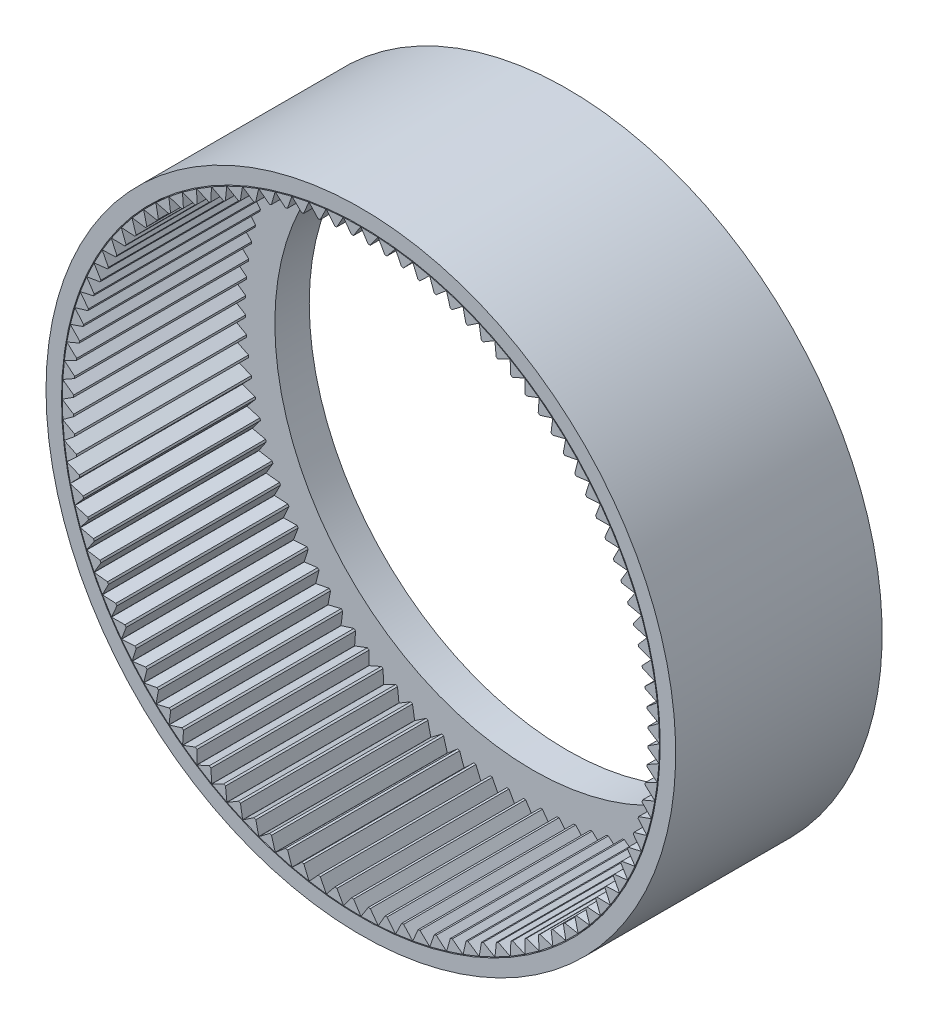
from build123d import *

# Parameters (mm, degrees)
SALIENTE_EXTRUIR1_DEPTH = 5
CROQUIS3_R              = 9.15
CROQUIS3_R_2            = 8.7
SALIENTE_EXTRUIR2_DEPTH = 5
CROQUIS4_R              = 9.15
CROQUIS4_R_2            = 7.5
SALIENTE_EXTRUIR5_DEPTH = 1


with BuildPart() as part:
    # Croquis2 → Saliente-Extruir1 (new body)
    with BuildSketch(Plane.XY):
        Polygon((0, 8.67551423), (0.210718239, 8.347340764), (0.270718239, 8.345610321), (0.5, 8.661093877), align=None)
        Polygon((0.504436291, 8.660836633), (1.002751901, 8.617368263), (0.755514311, 8.315750004), (0.695716438, 8.320966208), align=None)
        Polygon((1.007165728, 8.616853506), (1.502110807, 8.544484202), (1.237753961, 8.257751821), (1.178360552, 8.266436137), align=None)
        Polygon((1.506487236, 8.543713675), (1.996387045, 8.442688311), (1.715805444, 8.171812019), (1.657017467, 8.183935063), align=None)
        Polygon((2.000711268, 8.441664621), (2.483908141, 8.312325035), (2.188051185, 8.058221393), (2.13006756, 8.073742143), align=None)
        Polygon((2.488165526, 8.311051646), (2.963024479, 8.153835483), (2.652893253, 7.917364296), (2.595910178, 7.936230235), align=None)
        Polygon((2.96720062, 8.152316703), (3.43211488, 7.967755933), (3.10875877, 7.749717344), (3.052969058, 7.771864636), align=None)
        Polygon((3.436195646, 7.965996901), (3.88959209, 7.754716018), (3.554105231, 7.555847802), (3.499697658, 7.581201508), align=None)
        Polygon((3.893563674, 7.752722687), (4.333908152, 7.515436599), (3.987425725, 7.336411663), (3.934584388, 7.364885993), align=None)
        Polygon((4.337757115, 7.513215714), (4.76355964, 7.250727322), (4.407254033, 7.092151429), (4.35615773, 7.123650036), align=None)
        Polygon((4.767272959, 7.248286397), (5.177092751, 6.961483879), (4.812169588, 6.823893599), (4.762991213, 6.858309902), align=None)
        Polygon((5.18065786, 6.958831173), (5.573108219, 6.648684978), (5.200802284, 6.532545874), (5.153708241, 6.569763418), align=None)
        Polygon((5.576513054, 6.645829467), (5.950266052, 6.313389031), (5.571837112, 6.219094081), (5.526986753, 6.258986934), align=None)
        Polygon((5.953499094, 6.310340378), (6.307290069, 5.956730574), (5.924018607, 5.884598843), (5.88156369, 5.927032019), align=None)
        Polygon((6.310340378, 5.953499094), (6.642972212, 5.579916427), (6.256155098, 5.530191985), (6.216239278, 5.575021905), align=None)
        Polygon((6.645829467, 5.576513054), (6.956176641, 5.184221609), (6.567122741, 5.157072707), (6.52988108, 5.204147681), align=None)
        Polygon((6.958831173, 5.18065786), (7.245843569, 4.770985026), (6.855869319, 4.766503528), (6.821427831, 4.815664268), align=None)
        Polygon((7.248286397, 4.767272959), (7.510992857, 4.34160494), (7.121417805, 4.35980601), (7.08989303, 4.410886172), align=None)
        Polygon((7.513215714, 4.337757115), (7.750727322, 3.897534237), (7.362869668, 3.938356289), (7.334368275, 3.991183034), align=None)
        Polygon((7.752722687, 3.893563674), (7.96423578, 3.440275512), (7.57940791, 3.503580416), (7.554026339, 3.557974995), align=None)
        Polygon((7.965996901, 3.436195646), (8.150795784, 2.971375983), (7.770299835, 3.056949536), (7.74812397, 3.112727896), align=None)
        Polygon((8.152316703, 2.96720062), (8.309776076, 2.492422259), (7.934899526, 2.599974907), (7.916004401, 2.65694831), align=None)
        Polygon((8.311051646, 2.488165526), (8.440638716, 2.005034967), (8.072650028, 2.134202785), (8.057099579, 2.192178453), align=None)
        Polygon((8.441664621, 2.000711268), (8.542940906, 1.510863271), (8.183085237, 1.661209197), (8.170932083, 1.719990957), align=None)
        Polygon((8.543713675, 1.506487236), (8.616336489, 1.011579292), (8.265831477, 1.182594603), (8.257116739, 1.241983557), align=None)
        Polygon((8.616853506, 1.007165728), (8.660577116, 0.508872449), (8.320608759, 0.699978483), (8.315361926, 0.759773677), align=None)
        Polygon((8.660836633, 0.504436291), (8.675513092, 0.004443743), (8.347231735, 0.214993858), (8.34547056, 0.274992964), align=None)
        Polygon((8.67551423, 0), (8.661093877, -0.5), (8.345610321, -0.270718239), (8.347340764, -0.210718239), align=None)
        Polygon((8.660836633, -0.504436291), (8.617368263, -1.002751901), (8.315750004, -0.755514311), (8.320966208, -0.695716438), align=None)
        Polygon((8.616853506, -1.007165728), (8.544484202, -1.502110807), (8.257751821, -1.237753961), (8.266436137, -1.178360552), align=None)
        Polygon((8.543713675, -1.506487236), (8.442688311, -1.996387045), (8.171812019, -1.715805444), (8.183935063, -1.657017467), align=None)
        Polygon((8.441664621, -2.000711268), (8.312325035, -2.483908141), (8.058221393, -2.188051185), (8.073742143, -2.13006756), align=None)
        Polygon((8.311051646, -2.488165526), (8.153835483, -2.963024479), (7.917364296, -2.652893253), (7.936230235, -2.595910178), align=None)
        Polygon((8.152316703, -2.96720062), (7.967755933, -3.43211488), (7.749717344, -3.10875877), (7.771864636, -3.052969058), align=None)
        Polygon((7.965996901, -3.436195646), (7.754716018, -3.88959209), (7.555847802, -3.554105231), (7.581201508, -3.499697658), align=None)
        Polygon((7.752722687, -3.893563674), (7.515436599, -4.333908152), (7.336411663, -3.987425725), (7.364885993, -3.934584388), align=None)
        Polygon((7.513215714, -4.337757115), (7.250727322, -4.76355964), (7.092151429, -4.407254033), (7.123650036, -4.35615773), align=None)
        Polygon((7.248286397, -4.767272959), (6.961483879, -5.177092751), (6.823893599, -4.812169588), (6.858309902, -4.762991213), align=None)
        Polygon((6.958831173, -5.18065786), (6.648684978, -5.573108219), (6.532545874, -5.200802284), (6.569763418, -5.153708241), align=None)
        Polygon((6.645829467, -5.576513054), (6.313389031, -5.950266052), (6.219094081, -5.571837112), (6.258986934, -5.526986753), align=None)
        Polygon((6.310340378, -5.953499094), (5.956730574, -6.307290069), (5.884598843, -5.924018607), (5.927032019, -5.88156369), align=None)
        Polygon((5.953499094, -6.310340378), (5.579916427, -6.642972212), (5.530191985, -6.256155098), (5.575021905, -6.216239278), align=None)
        Polygon((5.576513054, -6.645829467), (5.184221609, -6.956176641), (5.157072707, -6.567122741), (5.204147681, -6.52988108), align=None)
        Polygon((5.18065786, -6.958831173), (4.770985026, -7.245843569), (4.766503528, -6.855869319), (4.815664268, -6.821427831), align=None)
        Polygon((4.767272959, -7.248286397), (4.34160494, -7.510992857), (4.35980601, -7.121417805), (4.410886172, -7.08989303), align=None)
        Polygon((4.337757115, -7.513215714), (3.897534237, -7.750727322), (3.938356289, -7.362869668), (3.991183034, -7.334368275), align=None)
        Polygon((3.893563674, -7.752722687), (3.440275512, -7.96423578), (3.503580416, -7.57940791), (3.557974995, -7.554026339), align=None)
        Polygon((3.436195646, -7.965996901), (2.971375983, -8.150795784), (3.056949536, -7.770299835), (3.112727896, -7.74812397), align=None)
        Polygon((2.96720062, -8.152316703), (2.492422259, -8.309776076), (2.599974907, -7.934899526), (2.65694831, -7.916004401), align=None)
        Polygon((2.488165526, -8.311051646), (2.005034967, -8.440638716), (2.134202785, -8.072650028), (2.192178453, -8.057099579), align=None)
        Polygon((2.000711268, -8.441664621), (1.510863271, -8.542940906), (1.661209197, -8.183085237), (1.719990957, -8.170932083), align=None)
        Polygon((1.506487236, -8.543713675), (1.011579292, -8.616336489), (1.182594603, -8.265831477), (1.241983557, -8.257116739), align=None)
        Polygon((1.007165728, -8.616853506), (0.508872449, -8.660577116), (0.699978483, -8.320608759), (0.759773677, -8.315361926), align=None)
        Polygon((0.504436291, -8.660836633), (0.004443743, -8.675513092), (0.214993858, -8.347231735), (0.274992964, -8.34547056), align=None)
        Polygon((0, -8.67551423), (-0.5, -8.661093877), (-0.270718239, -8.345610321), (-0.210718239, -8.347340764), align=None)
        Polygon((-0.504436291, -8.660836633), (-1.002751901, -8.617368263), (-0.755514311, -8.315750004), (-0.695716438, -8.320966208), align=None)
        Polygon((-1.007165728, -8.616853506), (-1.502110807, -8.544484202), (-1.237753961, -8.257751821), (-1.178360552, -8.266436137), align=None)
        Polygon((-1.506487236, -8.543713675), (-1.996387045, -8.442688311), (-1.715805444, -8.171812019), (-1.657017467, -8.183935063), align=None)
        Polygon((-2.000711268, -8.441664621), (-2.483908141, -8.312325035), (-2.188051185, -8.058221393), (-2.13006756, -8.073742143), align=None)
        Polygon((-2.488165526, -8.311051646), (-2.963024479, -8.153835483), (-2.652893253, -7.917364296), (-2.595910178, -7.936230235), align=None)
        Polygon((-2.96720062, -8.152316703), (-3.43211488, -7.967755933), (-3.10875877, -7.749717344), (-3.052969058, -7.771864636), align=None)
        Polygon((-3.436195646, -7.965996901), (-3.88959209, -7.754716018), (-3.554105231, -7.555847802), (-3.499697658, -7.581201508), align=None)
        Polygon((-3.893563674, -7.752722687), (-4.333908152, -7.515436599), (-3.987425725, -7.336411663), (-3.934584388, -7.364885993), align=None)
        Polygon((-4.337757115, -7.513215714), (-4.76355964, -7.250727322), (-4.407254033, -7.092151429), (-4.35615773, -7.123650036), align=None)
        Polygon((-4.767272959, -7.248286397), (-5.177092751, -6.961483879), (-4.812169588, -6.823893599), (-4.762991213, -6.858309902), align=None)
        Polygon((-5.18065786, -6.958831173), (-5.573108219, -6.648684978), (-5.200802284, -6.532545874), (-5.153708241, -6.569763418), align=None)
        Polygon((-5.576513054, -6.645829467), (-5.950266052, -6.313389031), (-5.571837112, -6.219094081), (-5.526986753, -6.258986934), align=None)
        Polygon((-5.953499094, -6.310340378), (-6.307290069, -5.956730574), (-5.924018607, -5.884598843), (-5.88156369, -5.927032019), align=None)
        Polygon((-6.310340378, -5.953499094), (-6.642972212, -5.579916427), (-6.256155098, -5.530191985), (-6.216239278, -5.575021905), align=None)
        Polygon((-6.645829467, -5.576513054), (-6.956176641, -5.184221609), (-6.567122741, -5.157072707), (-6.52988108, -5.204147681), align=None)
        Polygon((-6.958831173, -5.18065786), (-7.245843569, -4.770985026), (-6.855869319, -4.766503528), (-6.821427831, -4.815664268), align=None)
        Polygon((-7.248286397, -4.767272959), (-7.510992857, -4.34160494), (-7.121417805, -4.35980601), (-7.08989303, -4.410886172), align=None)
        Polygon((-7.513215714, -4.337757115), (-7.750727322, -3.897534237), (-7.362869668, -3.938356289), (-7.334368275, -3.991183034), align=None)
        Polygon((-7.752722687, -3.893563674), (-7.96423578, -3.440275512), (-7.57940791, -3.503580416), (-7.554026339, -3.557974995), align=None)
        Polygon((-7.965996901, -3.436195646), (-8.150795784, -2.971375983), (-7.770299835, -3.056949536), (-7.74812397, -3.112727896), align=None)
        Polygon((-8.152316703, -2.96720062), (-8.309776076, -2.492422259), (-7.934899526, -2.599974907), (-7.916004401, -2.65694831), align=None)
        Polygon((-8.311051646, -2.488165526), (-8.440638716, -2.005034967), (-8.072650028, -2.134202785), (-8.057099579, -2.192178453), align=None)
        Polygon((-8.441664621, -2.000711268), (-8.542940906, -1.510863271), (-8.183085237, -1.661209197), (-8.170932083, -1.719990957), align=None)
        Polygon((-8.543713675, -1.506487236), (-8.616336489, -1.011579292), (-8.265831477, -1.182594603), (-8.257116739, -1.241983557), align=None)
        Polygon((-8.616853506, -1.007165728), (-8.660577116, -0.508872449), (-8.320608759, -0.699978483), (-8.315361926, -0.759773677), align=None)
        Polygon((-8.660836633, -0.504436291), (-8.675513092, -0.004443743), (-8.347231735, -0.214993858), (-8.34547056, -0.274992964), align=None)
        Polygon((-8.67551423, 0), (-8.661093877, 0.5), (-8.345610321, 0.270718239), (-8.347340764, 0.210718239), align=None)
        Polygon((-8.660836633, 0.504436291), (-8.617368263, 1.002751901), (-8.315750004, 0.755514311), (-8.320966208, 0.695716438), align=None)
        Polygon((-8.616853506, 1.007165728), (-8.544484202, 1.502110807), (-8.257751821, 1.237753961), (-8.266436137, 1.178360552), align=None)
        Polygon((-8.543713675, 1.506487236), (-8.442688311, 1.996387045), (-8.171812019, 1.715805444), (-8.183935063, 1.657017467), align=None)
        Polygon((-8.441664621, 2.000711268), (-8.312325035, 2.483908141), (-8.058221393, 2.188051185), (-8.073742143, 2.13006756), align=None)
        Polygon((-8.311051646, 2.488165526), (-8.153835483, 2.963024479), (-7.917364296, 2.652893253), (-7.936230235, 2.595910178), align=None)
        Polygon((-8.152316703, 2.96720062), (-7.967755933, 3.43211488), (-7.749717344, 3.10875877), (-7.771864636, 3.052969058), align=None)
        Polygon((-7.965996901, 3.436195646), (-7.754716018, 3.88959209), (-7.555847802, 3.554105231), (-7.581201508, 3.499697658), align=None)
        Polygon((-7.752722687, 3.893563674), (-7.515436599, 4.333908152), (-7.336411663, 3.987425725), (-7.364885993, 3.934584388), align=None)
        Polygon((-7.513215714, 4.337757115), (-7.250727322, 4.76355964), (-7.092151429, 4.407254033), (-7.123650036, 4.35615773), align=None)
        Polygon((-7.248286397, 4.767272959), (-6.961483879, 5.177092751), (-6.823893599, 4.812169588), (-6.858309902, 4.762991213), align=None)
        Polygon((-6.958831173, 5.18065786), (-6.648684978, 5.573108219), (-6.532545874, 5.200802284), (-6.569763418, 5.153708241), align=None)
        Polygon((-6.645829467, 5.576513054), (-6.313389031, 5.950266052), (-6.219094081, 5.571837112), (-6.258986934, 5.526986753), align=None)
        Polygon((-6.310340378, 5.953499094), (-5.956730574, 6.307290069), (-5.884598843, 5.924018607), (-5.927032019, 5.88156369), align=None)
        Polygon((-5.953499094, 6.310340378), (-5.579916427, 6.642972212), (-5.530191985, 6.256155098), (-5.575021905, 6.216239278), align=None)
        Polygon((-5.576513054, 6.645829467), (-5.184221609, 6.956176641), (-5.157072707, 6.567122741), (-5.204147681, 6.52988108), align=None)
        Polygon((-5.18065786, 6.958831173), (-4.770985026, 7.245843569), (-4.766503528, 6.855869319), (-4.815664268, 6.821427831), align=None)
        Polygon((-4.767272959, 7.248286397), (-4.34160494, 7.510992857), (-4.35980601, 7.121417805), (-4.410886172, 7.08989303), align=None)
        Polygon((-4.337757115, 7.513215714), (-3.897534237, 7.750727322), (-3.938356289, 7.362869668), (-3.991183034, 7.334368275), align=None)
        Polygon((-3.893563674, 7.752722687), (-3.440275512, 7.96423578), (-3.503580416, 7.57940791), (-3.557974995, 7.554026339), align=None)
        Polygon((-3.436195646, 7.965996901), (-2.971375983, 8.150795784), (-3.056949536, 7.770299835), (-3.112727896, 7.74812397), align=None)
        Polygon((-2.96720062, 8.152316703), (-2.492422259, 8.309776076), (-2.599974907, 7.934899526), (-2.65694831, 7.916004401), align=None)
        Polygon((-2.488165526, 8.311051646), (-2.005034967, 8.440638716), (-2.134202785, 8.072650028), (-2.192178453, 8.057099579), align=None)
        Polygon((-2.000711268, 8.441664621), (-1.510863271, 8.542940906), (-1.661209197, 8.183085237), (-1.719990957, 8.170932083), align=None)
        Polygon((-1.506487236, 8.543713675), (-1.011579292, 8.616336489), (-1.182594603, 8.265831477), (-1.241983557, 8.257116739), align=None)
        Polygon((-1.007165728, 8.616853506), (-0.508872449, 8.660577116), (-0.699978483, 8.320608759), (-0.759773677, 8.315361926), align=None)
        Polygon((-0.504436291, 8.660836633), (-0.004443743, 8.675513092), (-0.214993858, 8.347231735), (-0.274992964, 8.34547056), align=None)
    extrude(amount=SALIENTE_EXTRUIR1_DEPTH)



with BuildPart() as body_2:
    # Croquis3 → Saliente-Extruir2 (new body)
    with BuildSketch(Plane(origin=(0, 0, 0), x_dir=(-1, 0, 0), z_dir=(0, 0, -1))):
        Circle(CROQUIS3_R)
        Circle(CROQUIS3_R_2, mode=Mode.SUBTRACT)
    extrude(amount=-SALIENTE_EXTRUIR2_DEPTH)


with BuildPart() as part_1:
    add(part.part)

    add(body_2.part)  # Saliente-Extruir5 merges body 2
    # Croquis4 → Saliente-Extruir5 (add)
    with BuildSketch(Plane(origin=(0, 0, 0), x_dir=(-1, 0, 0), z_dir=(0, 0, -1))):
        Circle(CROQUIS4_R)
        Circle(CROQUIS4_R_2, mode=Mode.SUBTRACT)
    extrude(amount=SALIENTE_EXTRUIR5_DEPTH)


solid = part_1.part
